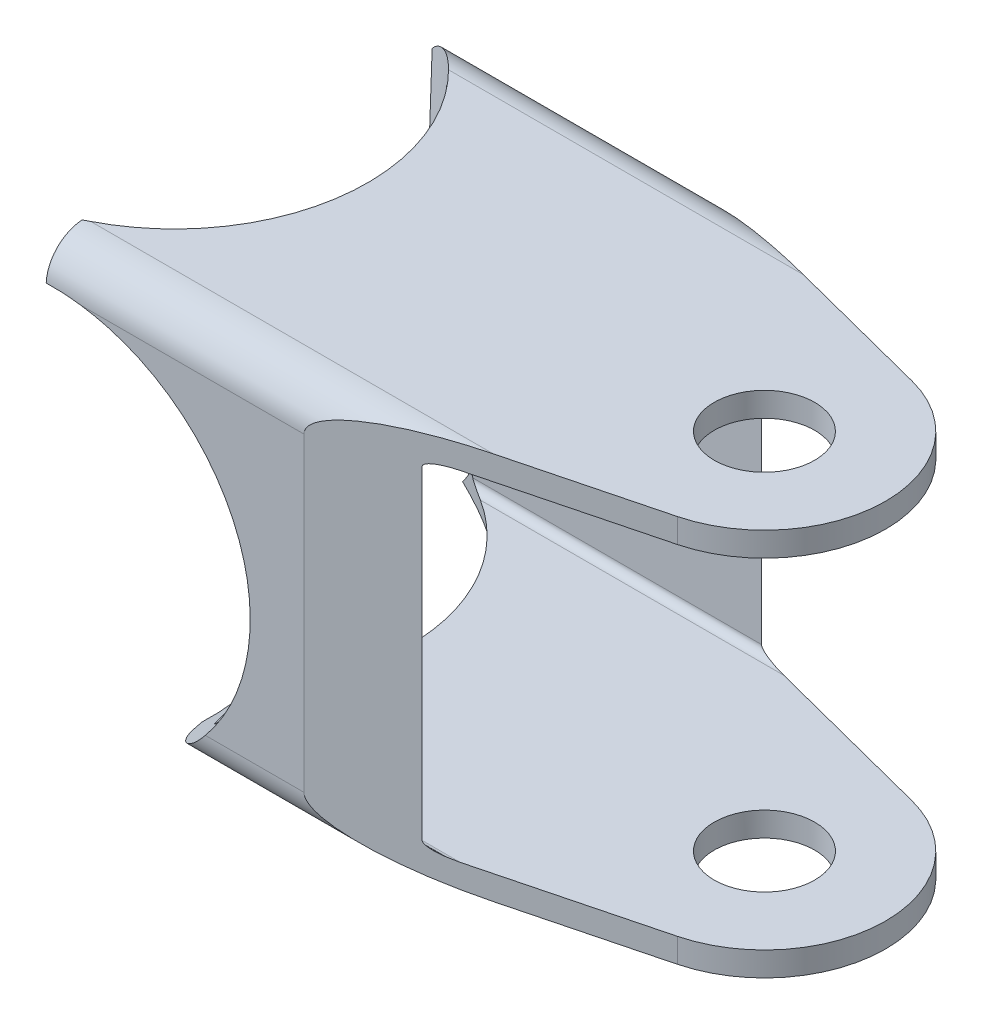
from build123d import *

# Parameters (mm, degrees)
BOSS_EXTRUDE1_DEPTH      = 25.4
BOSS_EXTRUDE1_DEPTH_BACK = 34.925
CUT_EXTRUDE4_DEPTH       = 63.941922635
CUT_EXTRUDE5_DEPTH       = 46.01339384
SKETCH14_R               = 3.2893
CUT_EXTRUDE6_DEPTH       = 46.01339384
SKETCH18_R               = 12.7
CUT_EXTRUDE7_DEPTH       = 51.720665187
CUT_EXTRUDE8_DEPTH       = 51.839007027
CUT_EXTRUDE8_DEPTH_BACK  = 51.839007027
SKETCH16_R               = 12.7
SKETCH20_R               = 12.7
CUT_EXTRUDE9_DEPTH       = 51.139702767
SKETCH22_R               = 12.7
CUT_EXTRUDE10_DEPTH      = 52.84130148
SKETCH23_W               = 25.492370658
SKETCH23_H               = 32.014055488
CUT_EXTRUDE11_DEPTH      = 46.013394002


with BuildPart() as part:
    # Sketch1 → Boss-Extrude1 (new, two sides: drawn at the far end of the back side and taken through both)
    with BuildSketch(Plane(origin=(0, 0, 0), x_dir=(0, 0, -1), z_dir=(1, 0, 0)).offset(-BOSS_EXTRUDE1_DEPTH_BACK)):
        with BuildLine():
            Line((-10.16, 12.7), (10.16, 12.7))
            ThreePointArc((10.16, 12.7), (11.956051224, 11.956051224), (12.7, 10.16))
            Line((12.7, 10.16), (12.7, -10.16))
            ThreePointArc((12.7, -10.16), (11.956051224, -11.956051224), (10.16, -12.7))
            Line((10.16, -12.7), (-10.16, -12.7))
            ThreePointArc((-10.16, -12.7), (-11.956051224, -11.956051224), (-12.7, -10.16))
            Line((-12.7, -10.16), (-12.7, 10.16))
            ThreePointArc((-12.7, 10.16), (-11.956051224, 11.956051224), (-10.16, 12.7))
        make_face()
    extrude(amount=BOSS_EXTRUDE1_DEPTH + BOSS_EXTRUDE1_DEPTH_BACK)

    # Sketch11 → Cut-Extrude4 (cut, through all)
    with BuildSketch(Plane(origin=(25.4, 0, 0), x_dir=(0, 0, -1), z_dir=(1, 0, 0))):
        with BuildLine():
            Line((-10.6045, 11.1125), (10.6045, 11.1125))
            ThreePointArc((10.6045, 11.1125), (10.963710245, 10.963710245), (11.1125, 10.6045))
            Line((11.1125, 10.6045), (11.1125, -10.6045))
            ThreePointArc((11.1125, -10.6045), (10.963710245, -10.963710245), (10.6045, -11.1125))
            Line((10.6045, -11.1125), (-10.6045, -11.1125))
            ThreePointArc((-10.6045, -11.1125), (-10.963710245, -10.963710245), (-11.1125, -10.6045))
            Line((-11.1125, -10.6045), (-11.1125, 10.6045))
            ThreePointArc((-11.1125, 10.6045), (-10.963710245, 10.963710245), (-10.6045, 11.1125))
        make_face()
    extrude(amount=-CUT_EXTRUDE4_DEPTH, mode=Mode.SUBTRACT)

    # Sketch12 → Cut-Extrude5 (cut, through all)
    with BuildSketch(Plane(origin=(0, 12.7, 0), x_dir=(1, 0, 0), z_dir=(0, 1, 0))):
        with BuildLine():
            Line((50.8, 12.7), (0, 12.7))
            Line((0, 12.7), (19.444424463, 7.686083637))
            ThreePointArc((19.444424463, 7.686083637), (25.4, 0), (19.444424463, -7.686083637))
            Line((19.444424463, -7.686083637), (0, -12.7))
            Line((0, -12.7), (50.8, -12.7))
            Line((50.8, -12.7), (50.8, 12.7))
        make_face()
    extrude(amount=-CUT_EXTRUDE5_DEPTH, mode=Mode.SUBTRACT)

    # Sketch14 → Cut-Extrude6 (cut, through all)
    with BuildSketch(Plane(origin=(0, 12.7, 0), x_dir=(1, 0, 0), z_dir=(0, 1, 0))):
        with Locations((17.4625, 0)):
            Circle(SKETCH14_R)
    extrude(amount=-CUT_EXTRUDE6_DEPTH, mode=Mode.SUBTRACT)

    # Sketch18 → Cut-Extrude7 (cut, through all)
    with BuildSketch(Plane(origin=(-22.032549239, 0, 0.006264188), x_dir=(-0.9646778836511669, -0.2634322564953612, -0.0001644143185974396), z_dir=(0.2634323078027938, -0.9646776957655352, -0.0006020782273420324))):
        with Locations((0.001368444, 0.004022543)):
            Circle(SKETCH18_R)
    extrude(amount=CUT_EXTRUDE7_DEPTH, mode=Mode.SUBTRACT)

    # Sketch16 → Cut-Extrude8 (cut, two sides: drawn at the far end of the back side and taken through both)
    with BuildSketch(Plane(origin=(-21.05316204, -3.591665644, 0), x_dir=(0.9505109286816292, -0.027539248521870206, -0.30946819585805213), z_dir=(0.31069112387834164, 0.08425202613115852, 0.9467695715621662)).offset(-CUT_EXTRUDE8_DEPTH_BACK)):
        Circle(SKETCH16_R)
    extrude(amount=CUT_EXTRUDE8_DEPTH + CUT_EXTRUDE8_DEPTH_BACK, mode=Mode.SUBTRACT)

    # Sketch20 → Cut-Extrude9 (cut, through all)
    with BuildSketch(Plane(origin=(-21.342077717, 0, -0.256772715), x_dir=(-0.9967672467857978, -0.08013235229688202, 0.005819093608885451), z_dir=(0.08034336148718564, -0.9941493945355035, 0.07219366737901169))):
        Circle(SKETCH20_R)
    extrude(amount=-CUT_EXTRUDE9_DEPTH, mode=Mode.SUBTRACT)


with BuildPart() as cut_extrude9_piece_1:
    # of the separate pieces the step leaves, piece 1, a body of its own (cut_extrude9_pieces)
    add(part.part.solids().sort_by_distance((-34.925, 10.16, 12.7))[0])

    # Sketch22 → Cut-Extrude10 (cut, through all)
    with BuildSketch(Plane(origin=(-22.052536122, -3.864575285, 0.004022768), x_dir=(0, 0, 1), z_dir=(-0.9646778706125473, -0.26343235554965805, 0))):
        Circle(SKETCH22_R)
    extrude(amount=CUT_EXTRUDE10_DEPTH, mode=Mode.SUBTRACT)


with BuildPart() as cut_extrude9_piece_2:
    # of the separate pieces the step leaves, piece 2, a body of its own (cut_extrude9_pieces)
    add(part.part.solids().sort_by_distance((-34.925, 12.7, -3.413330402))[0])


with BuildPart() as cut_extrude10_piece_1:
    # of the separate pieces the step leaves, piece 1, a body of its own (cut_extrude10_pieces)
    add(cut_extrude9_piece_1.part.solids().sort_by_distance((-34.925, 10.16, 12.7))[0])


with BuildPart() as cut_extrude10_piece_2:
    # of the separate pieces the step leaves, piece 2, a body of its own (cut_extrude10_pieces)
    add(cut_extrude9_piece_1.part.solids().sort_by_distance((-34.925, -12.021053183, 11.888606679))[0])


with BuildPart() as cut_extrude11_tool:
    # Sketch23 → Cut-Extrude11 (new, through all)
    with BuildSketch(Plane.XY.offset(12.7)):
        with Locations((-29.631725815, 0.252050166)):
            Rectangle(SKETCH23_W, SKETCH23_H)
    extrude(amount=-CUT_EXTRUDE11_DEPTH)


with BuildPart() as cut_extrude9_piece_2_1:
    add(cut_extrude9_piece_2.part)

    # Cut-Extrude11: cut by cut_extrude11_tool
    add(cut_extrude11_tool.part, mode=Mode.SUBTRACT)


with BuildPart() as cut_extrude10_piece_1_1:
    add(cut_extrude10_piece_1.part)

    # Cut-Extrude11: cut by cut_extrude11_tool
    add(cut_extrude11_tool.part, mode=Mode.SUBTRACT)


with BuildPart() as cut_extrude10_piece_2_1:
    add(cut_extrude10_piece_2.part)

    # Cut-Extrude11: cut by cut_extrude11_tool
    add(cut_extrude11_tool.part, mode=Mode.SUBTRACT)


solid = cut_extrude10_piece_1_1.part
